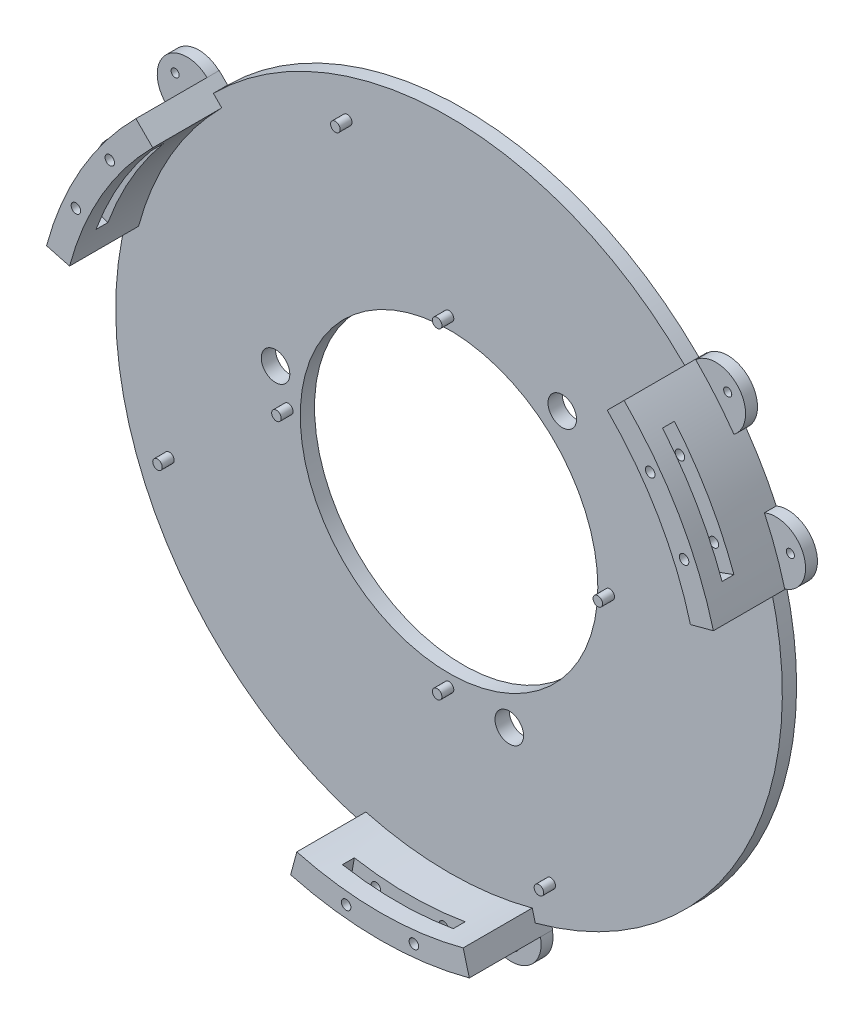
from build123d import *

# Parameters (mm, degrees)
ESTRUSIONE_ESTRUSIONE1_DEPTH         = 3
ESTRUSIONE_ESTRUSIONE1_DEPTH_BACK    = 3
SCHIZZO1_R                           = 140
SCHIZZO2_R                           = 62.5
TAGLIO_ESTRUSIONE1_DEPTH             = 199.080791598
SCHIZZO3_R                           = 2
ESTRUSIONE_ESTRUSIONE2_DEPTH         = 5
RIPETIZIONECIRCOLARE2_COUNT          = 4
SCHIZZO4_R                           = 2
ESTRUSIONE_ESTRUSIONE3_DEPTH         = 5
RIPETIZIONECIRCOLARE3_COUNT          = 4
ESTRUSIONE_ESTRUSIONE5_START         = -6
ESTRUSIONE_ESTRUSIONE5_DEPTH         = 35
RIPETIZIONECIRCOLARE10_COUNT         = 3
TAGLIO_ESTRUSIONE4_START             = -12.5
TAGLIO_ESTRUSIONE4_DEPTH             = 5
SCHIZZO13_R                          = 2
TAGLIO_ESTRUSIONE5_DEPTH             = 5
TAGLIO_ESTRUSIONE5_DIRECTION_2_REACH = 204.849
RIPETIZIONECIRCOLARE13_COUNT         = 3
ESTRUSIONE_ESTRUSIONE6_DEPTH         = 5
RIPETIZIONECIRCOLARE14_COUNT         = 3
SCHIZZO19_R                          = 6
TAGLIO_ESTRUSIONE6_DEPTH             = 6
FORO_PER_VITE_M3_2_D                 = 3.4
RIPETIZIONECIRCOLARE17_COUNT         = 3


with BuildPart() as part:
    # Schizzo1 → Estrusione-Estrusione1 (new, two sides: drawn at the far end of the back side and taken through both)
    with BuildSketch(Plane.XY.offset(-ESTRUSIONE_ESTRUSIONE1_DEPTH_BACK)):
        Circle(SCHIZZO1_R)
    extrude(amount=ESTRUSIONE_ESTRUSIONE1_DEPTH + ESTRUSIONE_ESTRUSIONE1_DEPTH_BACK)

    # Schizzo2 → Taglio-Estrusione1 (cut, through all)
    with BuildSketch(Plane.XY.offset(3)):
        Circle(SCHIZZO2_R)
    extrude(amount=-TAGLIO_ESTRUSIONE1_DEPTH, mode=Mode.SUBTRACT)

    # Schizzo3 → Estrusione-Estrusione2 (add)
    with BuildSketch(Plane.XY.offset(3)):
        with Locations((0, 67.5)):
            Circle(SCHIZZO3_R)
    estrusione_estrusione2 = extrude(amount=ESTRUSIONE_ESTRUSIONE2_DEPTH)

    # RipetizioneCircolare2: Estrusione-Estrusione2 ×4 about axis
    ripetizionecircolare2_axis = Axis((0, 0, 0), (0, 0, 1))
    for i in range(1, RIPETIZIONECIRCOLARE2_COUNT):
        add(estrusione_estrusione2.rotate(ripetizionecircolare2_axis, i * 360 / RIPETIZIONECIRCOLARE2_COUNT))

    # Schizzo4 → Estrusione-Estrusione3 (add)
    with BuildSketch(Plane.XY.offset(3)):
        with Locations((117.461577598, 42.752517916)):
            Circle(SCHIZZO4_R)
    estrusione_estrusione3 = extrude(amount=ESTRUSIONE_ESTRUSIONE3_DEPTH)

    # RipetizioneCircolare3: Estrusione-Estrusione3 ×4 about axis
    ripetizionecircolare3_axis = Axis((0, 0, 0), (0, 0, 1))
    for i in range(1, RIPETIZIONECIRCOLARE3_COUNT):
        add(estrusione_estrusione3.rotate(ripetizionecircolare3_axis, i * 360 / RIPETIZIONECIRCOLARE3_COUNT))

    # Schizzo6 → Estrusione-Estrusione5 (add)
    with BuildSketch(Plane.XY.offset(3).offset(ESTRUSIONE_ESTRUSIONE5_START)):
        with BuildLine():
            Line((95.45941546, 95.45941546), (98.994949366, 98.994949366))
            Line((98.994949366, 98.994949366), (102.530483272, 102.530483272))
            ThreePointArc((102.530483272, 102.530483272), (125.573683549, 72.5), (140.059244812, 37.52876154))
            Line((140.059244812, 37.52876154), (135.22961568, 36.234666314))
            Line((135.22961568, 36.234666314), (130.399986549, 34.940571089))
            ThreePointArc((130.399986549, 34.940571089), (116.913429511, 67.5), (95.45941546, 95.45941546))
        make_face()
    estrusione_estrusione5 = extrude(amount=ESTRUSIONE_ESTRUSIONE5_DEPTH)

    # RipetizioneCircolare10: Estrusione-Estrusione5 ×3 about axis
    ripetizionecircolare10_axis = Axis((0, 0, 0), (0, 0, 1))
    for i in range(1, RIPETIZIONECIRCOLARE10_COUNT):
        add(estrusione_estrusione5.rotate(ripetizionecircolare10_axis, i * 360 / RIPETIZIONECIRCOLARE10_COUNT))

    # Schizzo12 → Taglio-Estrusione4 (cut)
    with BuildSketch(Plane.XY.offset(32).offset(TAGLIO_ESTRUSIONE4_START)):
        with BuildLine():
            Line((-25, -142.828568571), (-23.275862069, -132.978322463))
            ThreePointArc((-23.275862069, -132.978322463), (0, -135), (23.275862069, -132.978322463))
            Line((23.275862069, -132.978322463), (25, -142.828568571))
            ThreePointArc((25, -142.828568571), (0, -145), (-25, -142.828568571))
        make_face()
    taglio_estrusione4 = extrude(amount=TAGLIO_ESTRUSIONE4_DEPTH, mode=Mode.SUBTRACT)

    # Schizzo13 → Taglio-Estrusione5 (cut)
    with BuildSketch(Plane.XY.offset(19.5)):
        with Locations((14.232392621, -139.274689015)):
            Circle(SCHIZZO13_R)
        with Locations((-14.232392621, -139.274689015)):
            Circle(SCHIZZO13_R)
    taglio_estrusione5 = extrude(amount=-TAGLIO_ESTRUSIONE5_DEPTH, mode=Mode.SUBTRACT)

    # Schizzo13 → Taglio-Estrusione5 direction 2 (cut, up to next)
    with BuildSketch(Plane.XY.offset(19.5), mode=Mode.PRIVATE) as taglio_estrusione5_direction_2_sk1:
        with Locations((14.232392621, -139.274689015)):
            Circle(SCHIZZO13_R)
    taglio_estrusione5_direction_2_tool1 = extrude(taglio_estrusione5_direction_2_sk1.sketch, amount=TAGLIO_ESTRUSIONE5_DIRECTION_2_REACH, mode=Mode.PRIVATE) & part.part
    # Schizzo13 → Taglio-Estrusione5 direction 2 (cut, up to next)
    with BuildSketch(Plane.XY.offset(19.5), mode=Mode.PRIVATE) as taglio_estrusione5_direction_2_sk2:
        with Locations((-14.232392621, -139.274689015)):
            Circle(SCHIZZO13_R)
    taglio_estrusione5_direction_2_tool2 = extrude(taglio_estrusione5_direction_2_sk2.sketch, amount=TAGLIO_ESTRUSIONE5_DIRECTION_2_REACH, mode=Mode.PRIVATE) & part.part
    taglio_estrusione5_direction_2_1 = taglio_estrusione5_direction_2_tool1.solids().sort_by_distance((14.232393, -139.274689, 19.5))[0]
    add(taglio_estrusione5_direction_2_1, mode=Mode.SUBTRACT)
    taglio_estrusione5_direction_2_2 = taglio_estrusione5_direction_2_tool2.solids().sort_by_distance((-14.232393, -139.274689, 19.5))[0]
    add(taglio_estrusione5_direction_2_2, mode=Mode.SUBTRACT)
    taglio_estrusione5_direction_2 = taglio_estrusione5_direction_2_1 + taglio_estrusione5_direction_2_2  # Taglio-Estrusione5 direction 2 as one shape, for the pattern or mirror that repeats it

    # RipetizioneCircolare13: Taglio-Estrusione4, Taglio-Estrusione5, Taglio-Estrusione5 direction 2 ×3 about axis
    ripetizionecircolare13_axis = Axis((0, 0, 0), (0, 0, 1))
    add([taglio_estrusione4.rotate(ripetizionecircolare13_axis, i * 360 / RIPETIZIONECIRCOLARE13_COUNT) for i in range(1, RIPETIZIONECIRCOLARE13_COUNT)], mode=Mode.SUBTRACT)
    add([taglio_estrusione5.rotate(ripetizionecircolare13_axis, i * 360 / RIPETIZIONECIRCOLARE13_COUNT) for i in range(1, RIPETIZIONECIRCOLARE13_COUNT)], mode=Mode.SUBTRACT)
    add([taglio_estrusione5_direction_2.rotate(ripetizionecircolare13_axis, i * 360 / RIPETIZIONECIRCOLARE13_COUNT) for i in range(1, RIPETIZIONECIRCOLARE13_COUNT)], mode=Mode.SUBTRACT)

    # Schizzo14 → Estrusione-Estrusione6 (add)
    with BuildSketch(Plane(origin=(0, 0, -3), x_dir=(-1, 0, 0), z_dir=(0, 0, -1))):
        with BuildLine():
            ThreePointArc((-102.636327137, 102.42453003), (-111.076444252, 93.204203405), (-118.691082442, 83.291217717))
            ThreePointArc((-118.691082442, 83.291217717), (-120.651999791, 101.239048526), (-102.636327137, 102.42453003))
        make_face()
        with BuildLine():
            ThreePointArc((-131.477851676, 61.143883739), (-148.001587774, 53.868172574), (-140.020408545, 37.673401637))
            ThreePointArc((-140.020408545, 37.673401637), (-136.255430014, 49.592920782), (-131.477851676, 61.143883739))
        make_face()
    estrusione_estrusione6 = extrude(amount=-ESTRUSIONE_ESTRUSIONE6_DEPTH)

    # RipetizioneCircolare14: Estrusione-Estrusione6 ×3 about axis
    ripetizionecircolare14_axis = Axis((0, 0, 0), (0, 0, 1))
    for i in range(1, RIPETIZIONECIRCOLARE14_COUNT):
        add(estrusione_estrusione6.rotate(ripetizionecircolare14_axis, i * 360 / RIPETIZIONECIRCOLARE14_COUNT))

    # Schizzo19 → Taglio-Estrusione6 (cut)
    with BuildSketch(Plane.XY.offset(3)):
        with Locations((-72.875773723, 12.849965147)):
            Circle(SCHIZZO19_R)
        with Locations((47.566283117, 56.687288791)):
            Circle(SCHIZZO19_R)
        with Locations((25.309490606, -69.537253938)):
            Circle(SCHIZZO19_R)
    extrude(amount=-TAGLIO_ESTRUSIONE6_DEPTH, mode=Mode.SUBTRACT)

    # Foro per Vite M3-2 (through all)
    with Locations(Plane.XY.offset(2)):
        with Locations((-26.307698917, -149.198374581), (26.307698917, -149.198374581)):
            foro_per_vite_m3_2 = Hole(FORO_PER_VITE_M3_2_D / 2)

    # RipetizioneCircolare17: Foro per Vite M3-2 ×3 about axis
    ripetizionecircolare17_axis = Axis((0, 0, 0), (0, 0, 1))
    for i in range(1, RIPETIZIONECIRCOLARE17_COUNT):
        add(foro_per_vite_m3_2.rotate(ripetizionecircolare17_axis, i * 360 / RIPETIZIONECIRCOLARE17_COUNT), mode=Mode.SUBTRACT)


solid = part.part
